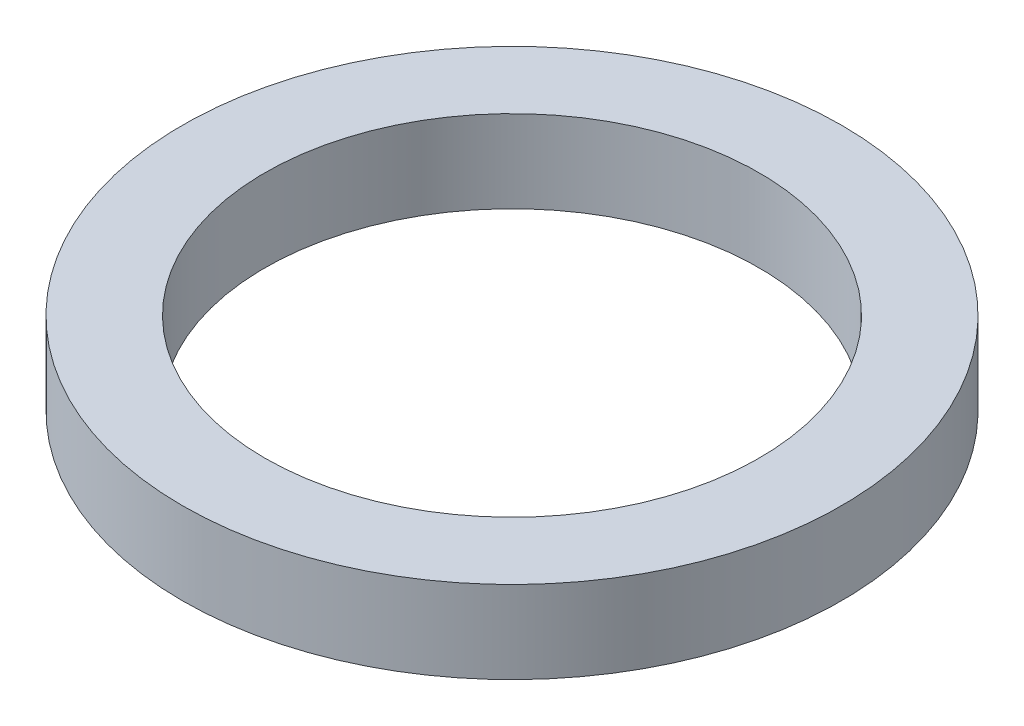
from build123d import *

# Parameters (mm, degrees)
SKETCH1_R           = 16
SKETCH1_R_2         = 12
BOSS_EXTRUDE1_DEPTH = 4


with BuildPart() as part:
    # Sketch1 → Boss-Extrude1 (new body)
    with BuildSketch(Plane(origin=(0, 0, 0), x_dir=(1, 0, 0), z_dir=(0, 1, 0))):
        with Locations(Location((0, 0, 0), (0, 0, 270))):
            Circle(SKETCH1_R)
        with Locations(Location((0, 0, 0), (0, 0, 270))):
            Circle(SKETCH1_R_2, mode=Mode.SUBTRACT)
    extrude(amount=BOSS_EXTRUDE1_DEPTH)


solid = part.part
